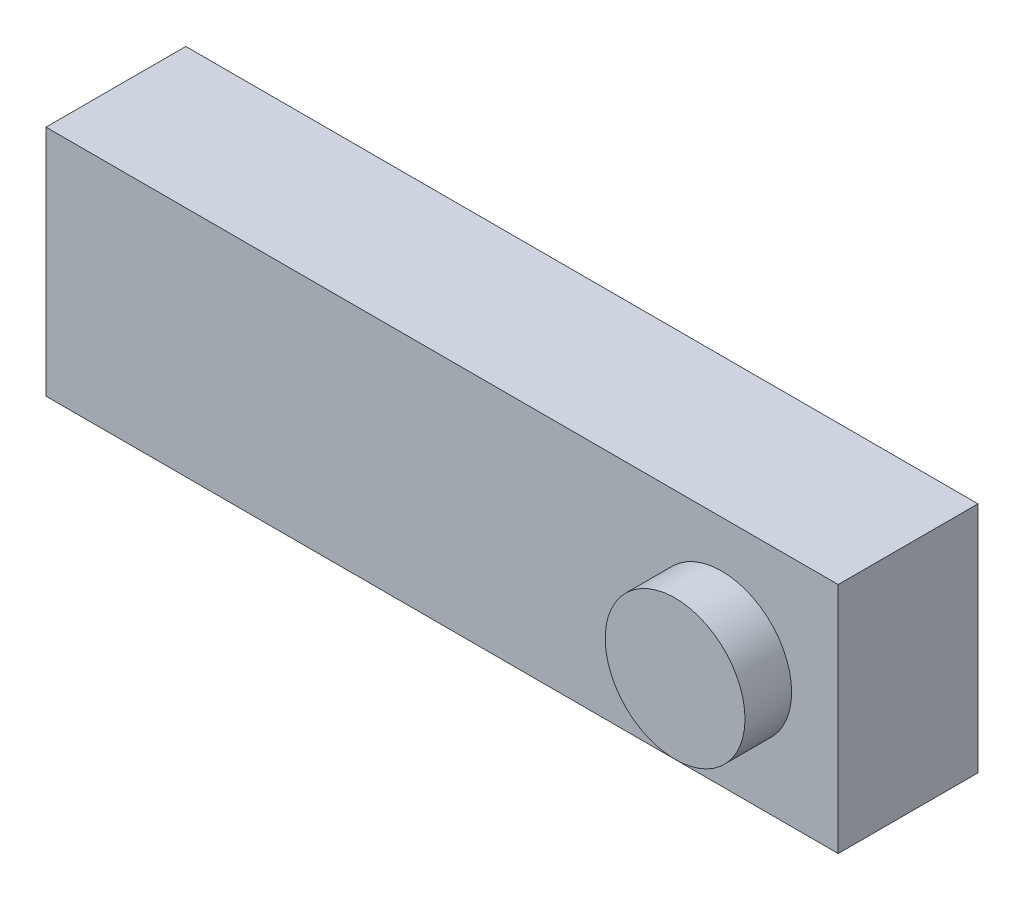
from build123d import *

# Parameters (mm, degrees)
CROQUIS2_W              = 850
CROQUIS2_H              = 250
SALIENTE_EXTRUIR1_DEPTH = 150
CROQUIS3_R              = 75
CORTAR_EXTRUIR1_DEPTH   = 50
CROQUIS4_R              = 75
SALIENTE_EXTRUIR2_DEPTH = 50


with BuildPart() as part:
    # Croquis2 → Saliente-Extruir1 (new body)
    with BuildSketch(Plane.XY.offset(3.171613416)):
        with Locations((916.834843653, 1024.026997685)):
            Rectangle(CROQUIS2_W, CROQUIS2_H)
    extrude(amount=SALIENTE_EXTRUIR1_DEPTH)

    # Croquis3 → Cortar-Extruir1 (cut)
    with BuildSketch(Plane(origin=(0, 0, 3.171613416), x_dir=(-1, 0, 0), z_dir=(0, 0, -1))):
        with Locations((-616.834843653, 1024.026997685)):
            Circle(CROQUIS3_R)
    extrude(amount=-CORTAR_EXTRUIR1_DEPTH, mode=Mode.SUBTRACT)

    # Croquis4 → Saliente-Extruir2 (add)
    with BuildSketch(Plane.XY.offset(153.171613416)):
        with Locations((1216.834843653, 1024.026997685)):
            Circle(CROQUIS4_R)
    extrude(amount=SALIENTE_EXTRUIR2_DEPTH)


solid = part.part
